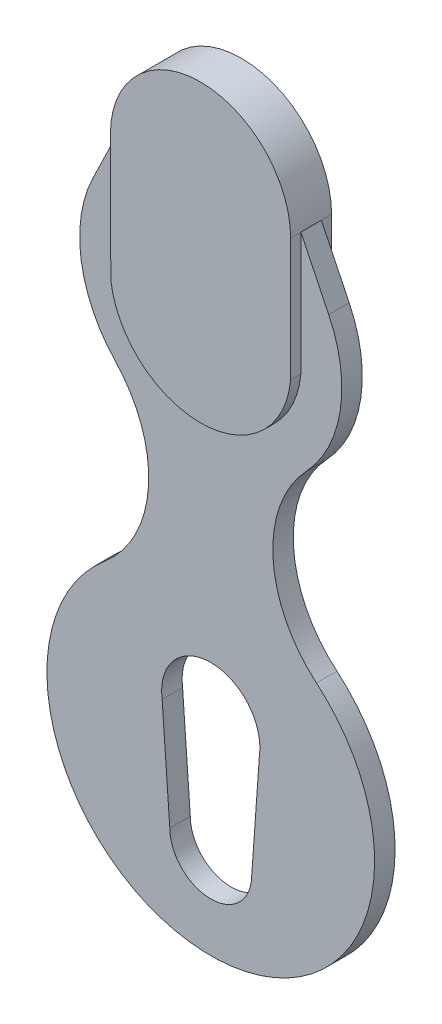
from build123d import *

# Parameters (mm, degrees)
BOSS_EXTRUDE2_DEPTH = 5
BOSS_EXTRUDE4_DEPTH = 2.5


with BuildPart() as part:
    # Sketch1 → Boss-Extrude2 (new, symmetric)
    with BuildSketch(Plane.XY):
        with BuildLine():
            Line((22, 94), (22, 124))
            ThreePointArc((22, 124), (0, 146), (-22, 124))
            Line((-22, 124), (-21.902773493, 93.124497726))
            ThreePointArc((-21.902773493, 93.124497726), (0.440442172, 73.913669144), (22, 94))
        make_face()
    extrude(amount=BOSS_EXTRUDE2_DEPTH, both=True)

    # Sketch1<7> → Boss-Extrude4 (add, symmetric)
    with BuildSketch(Plane.XY):
        with BuildLine():
            Line((28.804390709, 109.9394073), (22, 124))
            Line((22, 124), (22, 94))
            ThreePointArc((22, 94), (0.440442172, 73.913669144), (-21.902773493, 93.124497726))
            Line((-21.902773493, 93.124497726), (-22, 124))
            Line((-22, 124), (-28.804390709, 109.9394073))
            ThreePointArc((-28.804390709, 109.9394073), (-31.629698625, 91.14591256), (-23.298809999, 74.064516129))
            ThreePointArc((-23.298809999, 74.064516129), (-15.190736019, 51.78096855), (-25.79511107, 30.571428571))
            ThreePointArc((-25.79511107, 30.571428571), (0, -40), (25.79511107, 30.571428571))
            ThreePointArc((25.79511107, 30.571428571), (15.190736019, 51.78096855), (23.298809999, 74.064516129))
            ThreePointArc((23.298809999, 74.064516129), (31.629698625, 91.14591256), (28.804390709, 109.9394073))
        make_face()
        with BuildLine():
            ThreePointArc((-11.878172589, 8.294416244), (-11.969504398, 9.1450354), (-12, 10))
            ThreePointArc((-12, 10), (0, 22), (12, 10))
            ThreePointArc((12, 10), (11.969504398, 9.1450354), (11.878172589, 8.294416244))
            Line((11.878172589, 8.294416244), (10, -18))
            ThreePointArc((10, -18), (0, -28), (-10, -18))
            Line((-10, -18), (-11.878172589, 8.294416244))
        make_face(mode=Mode.SUBTRACT)
    extrude(amount=BOSS_EXTRUDE4_DEPTH, both=True)


solid = part.part
